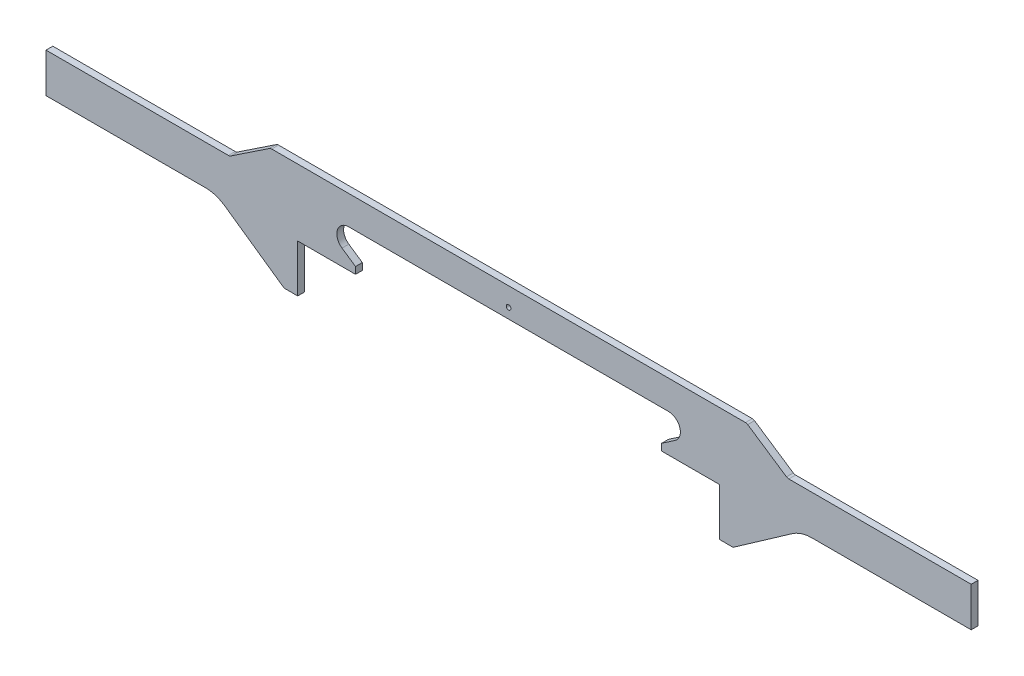
from build123d import *

# Parameters (mm, degrees)
EXTRUDE_1_DEPTH        = 10
FILLET_1_R             = 6
HOLE_WIZARD_M8_1_D     = 6.8
HOLE_WIZARD_M8_1_DEPTH = 19.75
HOLE_WIZARD_M8_1_TIP   = 2.042926105
FILLET_2_R             = 50


with BuildPart() as part:
    # 草图1 → 凸台-拉伸1 (new body)
    with BuildSketch(Plane.XY):
        with BuildLine():
            Line((-350, 0), (350, 0))
            Line((350, 0), (410, -40))
            Line((410, -40), (680, -40))
            Line((680, -40), (680, -98))
            Line((680, -98), (429.970360472, -98))
            Line((429.970360472, -98), (330, -168))
            Line((330, -168), (310, -168))
            Line((310, -168), (310, -98))
            Line((310, -98), (225, -98))
            Line((225, -98), (225, -88))
            Line((225, -88), (244.858994383, -74.458569423))
            ThreePointArc((244.858994383, -74.458569423), (251.722364739, -54.841267835), (235, -42.5))
            Line((235, -42.5), (-235, -42.5))
            ThreePointArc((-235, -42.5), (-251.722364739, -54.841267835), (-244.858994383, -74.458569423))
            Line((-244.858994383, -74.458569423), (-225, -88))
            Line((-225, -88), (-225, -98))
            Line((-225, -98), (-310, -98))
            Line((-310, -98), (-310, -168))
            Line((-310, -168), (-330, -168))
            Line((-330, -168), (-429.970360472, -98))
            Line((-429.970360472, -98), (-680, -98))
            Line((-680, -98), (-680, -40))
            Line((-680, -40), (-410, -40))
            Line((-410, -40), (-350, 0))
        make_face()
    extrude(amount=EXTRUDE_1_DEPTH)

    # 圆角1
    fillet_1_edges = [part.edges().sort_by_distance(p)[0] for p in [
        (-350, 0, 5),
        (350, 0, 5),
        (410, -40, 5),
        (-410, -40, 5),
    ]]
    fillet(fillet_1_edges, radius=FILLET_1_R)

    # M8 螺纹孔1
    with Locations(Plane.XY.offset(10)):
        with Locations((0, -27.5)):
            Hole(HOLE_WIZARD_M8_1_D / 2, depth=HOLE_WIZARD_M8_1_DEPTH)
            with Locations((0, 0, -(HOLE_WIZARD_M8_1_DEPTH + HOLE_WIZARD_M8_1_TIP / 2))):  # 118° drill point
                Cone(0, HOLE_WIZARD_M8_1_D / 2, HOLE_WIZARD_M8_1_TIP, mode=Mode.SUBTRACT)

    # 圆角2
    fillet_2_edges = [part.edges().sort_by_distance(p)[0] for p in [
        (429.970360472, -98, 5),
        (-429.970360472, -98, 5),
    ]]
    fillet(fillet_2_edges, radius=FILLET_2_R)


solid = part.part
